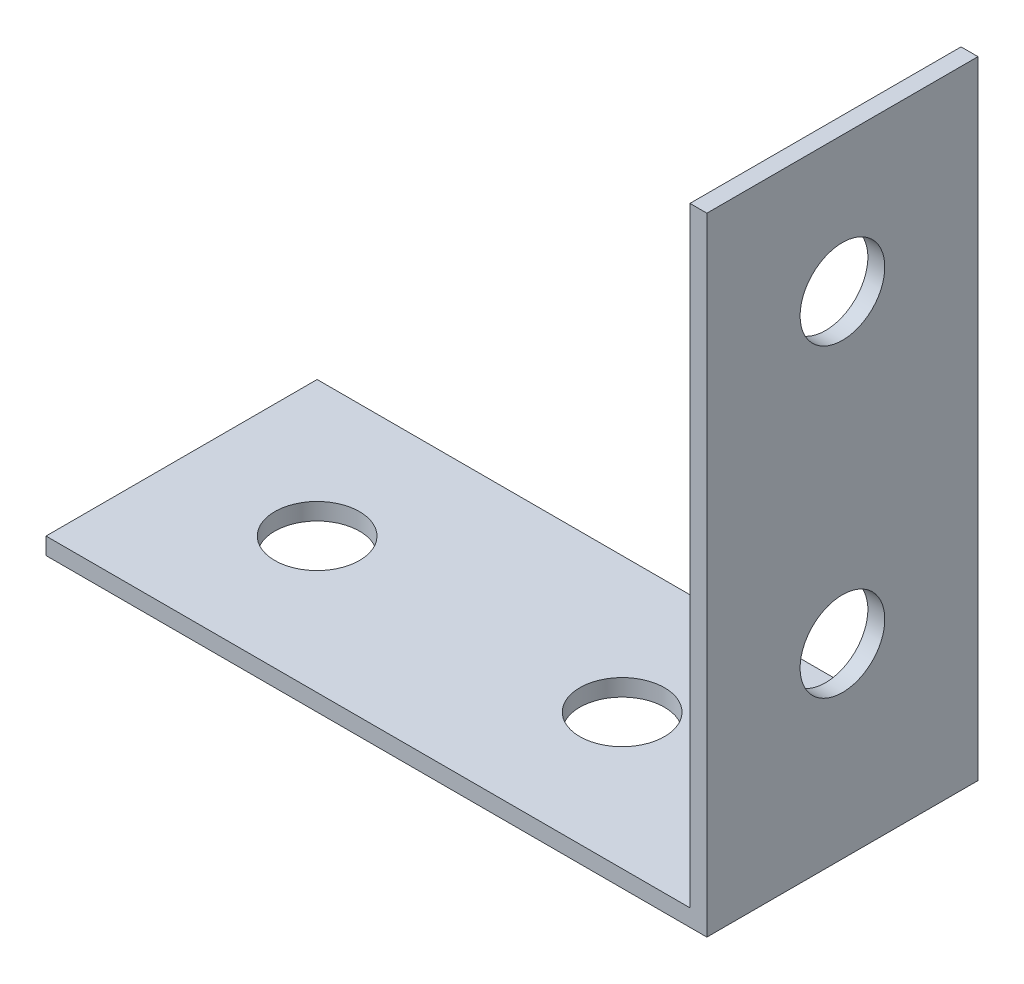
from build123d import *

# Parameters (mm, degrees)
SKETCH_1_W          = 38
SKETCH_1_H          = 16
EXTRUDE_1_DEPTH     = 1
SKETCH_2_W          = 16
SKETCH_2_H          = 37
EXTRUDE_2_DEPTH     = 1
CUT_EXTRUDE_1_REACH = 43.952
SKETCH_3_R          = 2.5
CUT_EXTRUDE_2_REACH = 55.638
SKETCH_4_R          = 2.5


with BuildPart() as part:
    # 草圖1 → 填料-伸長1 (new body)
    with BuildSketch(Plane(origin=(0, 0, 0), x_dir=(1, 0, 0), z_dir=(0, 1, 0))):
        Rectangle(SKETCH_1_W, SKETCH_1_H)
    extrude(amount=EXTRUDE_1_DEPTH)

    # 草圖2 → 填料-伸長2 (add)
    with BuildSketch(Plane(origin=(19, 0, 0), x_dir=(0, 0, -1), z_dir=(1, 0, 0))):
        with Locations((0, 18.5)):
            Rectangle(SKETCH_2_W, SKETCH_2_H)
    extrude(amount=EXTRUDE_2_DEPTH)

    # 草圖3 → 除料-伸長1 (cut, up to next)
    with BuildSketch(Plane(origin=(0, 1, 0), x_dir=(1, 0, 0), z_dir=(0, 1, 0)), mode=Mode.PRIVATE) as cut_extrude_1_sk1:
        with Locations(Location((-11, 0, 0), (0, 0, 270))):
            Circle(SKETCH_3_R)
    cut_extrude_1_tool1 = extrude(cut_extrude_1_sk1.sketch, amount=-CUT_EXTRUDE_1_REACH, mode=Mode.PRIVATE) & part.part
    # 草圖3 → 除料-伸長1 (cut, up to next)
    with BuildSketch(Plane(origin=(0, 1, 0), x_dir=(1, 0, 0), z_dir=(0, 1, 0)), mode=Mode.PRIVATE) as cut_extrude_1_sk2:
        with Locations(Location((7, 0, 0), (0, 0, 270))):
            Circle(SKETCH_3_R)
    cut_extrude_1_tool2 = extrude(cut_extrude_1_sk2.sketch, amount=-CUT_EXTRUDE_1_REACH, mode=Mode.PRIVATE) & part.part
    add(cut_extrude_1_tool1.solids().sort_by_distance((-11, 1, 0))[0], mode=Mode.SUBTRACT)
    add(cut_extrude_1_tool2.solids().sort_by_distance((7, 1, 0))[0], mode=Mode.SUBTRACT)

    # 草圖4 → 除料-伸長2 (cut, up to next)
    with BuildSketch(Plane.ZY.offset(-19), mode=Mode.PRIVATE) as cut_extrude_2_sk1:
        with Locations((0, 29)):
            Circle(SKETCH_4_R)
    cut_extrude_2_tool1 = extrude(cut_extrude_2_sk1.sketch, amount=-CUT_EXTRUDE_2_REACH, mode=Mode.PRIVATE) & part.part
    # 草圖4 → 除料-伸長2 (cut, up to next)
    with BuildSketch(Plane.ZY.offset(-19), mode=Mode.PRIVATE) as cut_extrude_2_sk2:
        with Locations((0, 11)):
            Circle(SKETCH_4_R)
    cut_extrude_2_tool2 = extrude(cut_extrude_2_sk2.sketch, amount=-CUT_EXTRUDE_2_REACH, mode=Mode.PRIVATE) & part.part
    add(cut_extrude_2_tool1.solids().sort_by_distance((19, 29, 0))[0], mode=Mode.SUBTRACT)
    add(cut_extrude_2_tool2.solids().sort_by_distance((19, 11, 0))[0], mode=Mode.SUBTRACT)


solid = part.part
